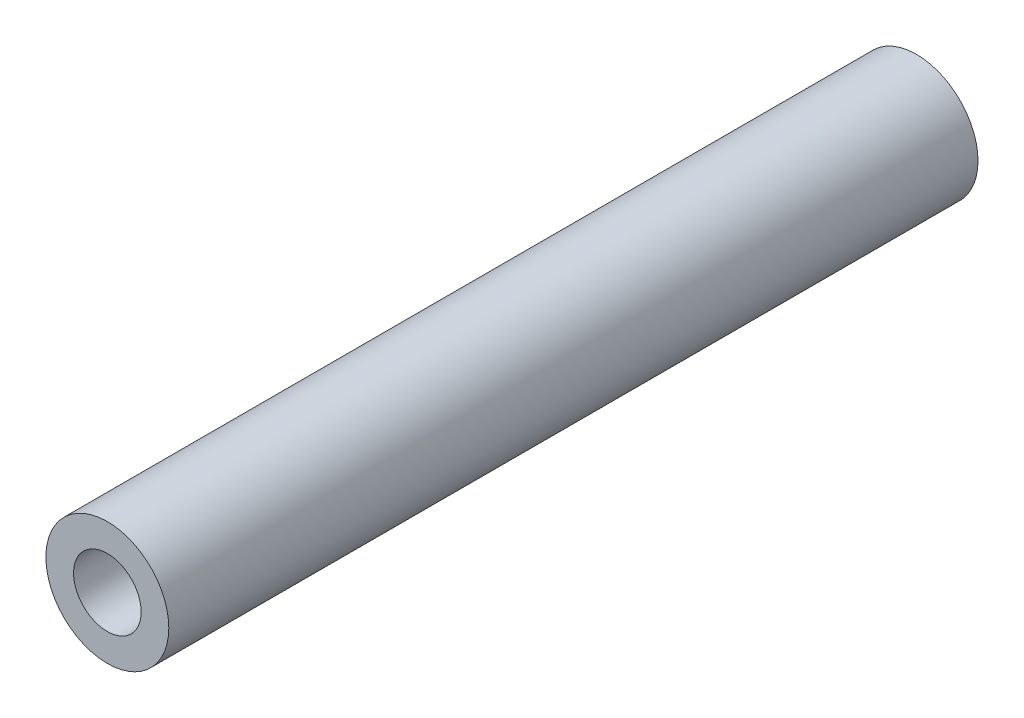
from build123d import *

# Parameters (mm, degrees)
SKETCH_1_R         = 3
EXTRUDE_1_DEPTH    = 39.5
HOLE_WIZARD_M4_1_D = 3.3


with BuildPart() as part:
    # 草图1 → 凸台-拉伸1 (new body)
    with BuildSketch(Plane.XY):
        Circle(SKETCH_1_R)
    extrude(amount=EXTRUDE_1_DEPTH)

    # M4 螺纹孔1 (through all)
    with Locations(Plane.XY.offset(39.5)):
        with Locations((0, 0)):
            Hole(HOLE_WIZARD_M4_1_D / 2)


solid = part.part
